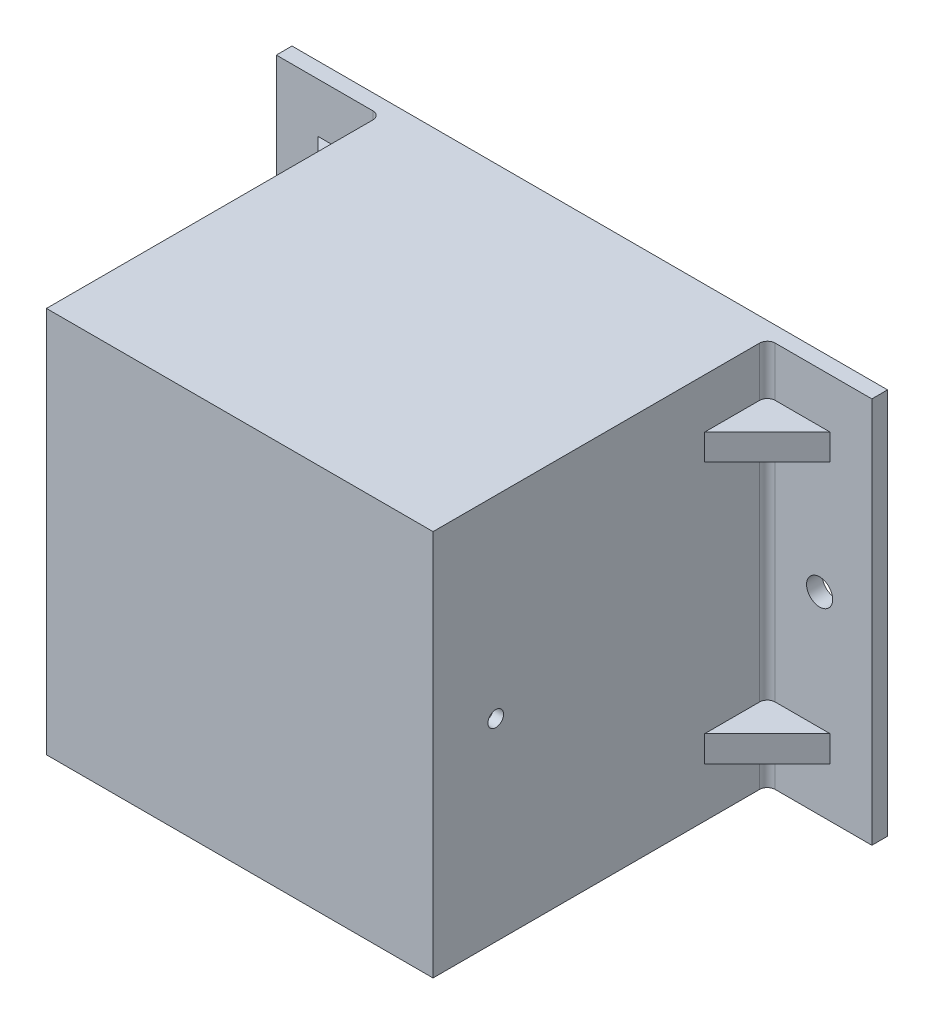
from build123d import *

# Parameters (mm, degrees)
SKETCH_1_W          = 74
SKETCH_1_H          = 74
SKETCH_1_W_2        = 70
SKETCH_1_H_2        = 70
EXTRUDE_1_DEPTH     = 65
SKETCH_2_W          = 74
SKETCH_2_H          = 74
EXTRUDE_2_DEPTH     = 2
SKETCH_3_W          = 20
SKETCH_3_H          = 74
EXTRUDE_3_DEPTH     = 3
EXTRUDE_4_DEPTH     = 2.5
EXTRUDE_5_DEPTH     = 2.5
SKETCH_6_R          = 2.5
CUT_EXTRUDE_1_DEPTH = 5
FILLET_1_R          = 1.5
SKETCH_7_W          = 8
SKETCH_7_H          = 50
CUT_EXTRUDE_2_DEPTH = 5
SKETCH_9_R          = 1.5
CUT_EXTRUDE_3_DEPTH = 5


with BuildPart() as part:
    # 草图1 → 凸台-拉伸1 (new body)
    with BuildSketch(Plane.XY):
        Rectangle(SKETCH_1_W, SKETCH_1_H)
        Rectangle(SKETCH_1_W_2, SKETCH_1_H_2, mode=Mode.SUBTRACT)
    extrude(amount=EXTRUDE_1_DEPTH)

    # 草图2 → 凸台-拉伸2 (add)
    with BuildSketch(Plane.XY.offset(65)):
        Rectangle(SKETCH_2_W, SKETCH_2_H)
    extrude(amount=EXTRUDE_2_DEPTH)

    # 草图3 → 凸台-拉伸3 (add)
    with BuildSketch(Plane(origin=(0, 0, 0), x_dir=(-1, 0, 0), z_dir=(0, 0, -1))):
        with Locations((-47, 0)):
            Rectangle(SKETCH_3_W, SKETCH_3_H)
        with Locations((47, 0)):
            Rectangle(SKETCH_3_W, SKETCH_3_H)
    extrude(amount=-EXTRUDE_3_DEPTH)

    # 草图4 → 凸台-拉伸4 (add, symmetric)
    with BuildSketch(Plane(origin=(0, 25, 0), x_dir=(1, 0, 0), z_dir=(0, 1, 0))):
        Polygon((-37, -15), (-49, -3), (-37, -3), align=None)
    extrude_4 = extrude(amount=EXTRUDE_4_DEPTH, both=True)

    # 草图5 → 凸台-拉伸5 (add, symmetric)
    with BuildSketch(Plane(origin=(0, -25, 0), x_dir=(1, 0, 0), z_dir=(0, 1, 0))):
        Polygon((-37, -15), (-37, -3), (-49, -3), align=None)
    extrude_5 = extrude(amount=EXTRUDE_5_DEPTH, both=True)

    # 镜向1: 凸台-拉伸4, 凸台-拉伸5 across plane
    add(extrude_4.mirror(Plane(origin=(0, 0, 0), x_dir=(0, 0, 1), z_dir=(1, 0, 0))))
    add(extrude_5.mirror(Plane(origin=(0, 0, 0), x_dir=(0, 0, 1), z_dir=(1, 0, 0))))

    # 草图6 → 切除-拉伸1 (cut)
    with BuildSketch(Plane.XY.offset(3)):
        with Locations((47, 0)):
            Circle(SKETCH_6_R)
        with Locations((-47, 0)):
            Circle(SKETCH_6_R)
    extrude(amount=-CUT_EXTRUDE_1_DEPTH, mode=Mode.SUBTRACT)

    # 圆角1
    fillet_1_edges = [part.edges().sort_by_distance(p)[0] for p in [
        (37, 0, 3),
        (-37, 32.25, 3),
        (37, -32.25, 3),
        (-37, 0, 3),
        (-37, -32.25, 3),
        (37, 32.25, 3),
    ]]
    fillet(fillet_1_edges, radius=FILLET_1_R)

    # 草图7 → 切除-拉伸2 (cut)
    with BuildSketch(Plane.XZ.offset(37)):
        with Locations((0, 25)):
            Rectangle(SKETCH_7_W, SKETCH_7_H)
    extrude(amount=-CUT_EXTRUDE_2_DEPTH, mode=Mode.SUBTRACT)

    # 草图9 → 切除-拉伸3 (cut)
    with BuildSketch(Plane(origin=(37, 0, 0), x_dir=(0, 0, -1), z_dir=(1, 0, 0))):
        with Locations((-55, 0)):
            Circle(SKETCH_9_R)
    extrude(amount=-CUT_EXTRUDE_3_DEPTH, mode=Mode.SUBTRACT)


solid = part.part
